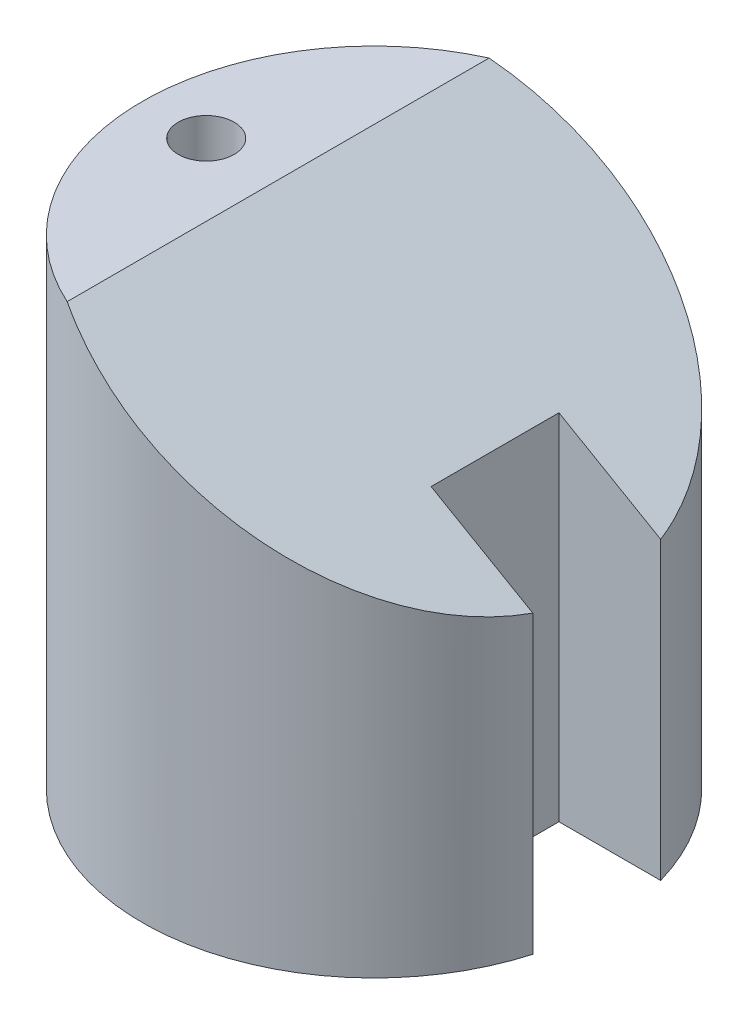
from build123d import *

# Parameters (mm, degrees)
SKETCH1_R               = 29
BOSS_EXTRUDE1_DEPTH     = 60
CUT_EXTRUDE1_DEPTH      = 73.677369242
CUT_EXTRUDE1_DEPTH_BACK = 73.677369242
CUT_EXTRUDE3_DEPTH      = 8
CUT_EXTRUDE3_DEPTH_BACK = 8
CUT_EXTRUDE4_REACH      = 74.677
SKETCH7_R               = 3.5


with BuildPart() as part:
    # Sketch1 → Boss-Extrude1 (new body)
    with BuildSketch(Plane(origin=(0, 0, 0), x_dir=(1, 0, 0), z_dir=(0, 1, 0))):
        Circle(SKETCH1_R)
    extrude(amount=BOSS_EXTRUDE1_DEPTH)

    # Sketch2 → Cut-Extrude1 (cut, two sides: drawn at the far end of the back side and taken through both)
    with BuildSketch(Plane.XY.offset(-CUT_EXTRUDE1_DEPTH_BACK)):
        Polygon((-12, 60), (29, 36.328638963), (29, 60), align=None)
    extrude(amount=CUT_EXTRUDE1_DEPTH + CUT_EXTRUDE1_DEPTH_BACK, mode=Mode.SUBTRACT)

    # Sketch6 → Cut-Extrude3 (cut, two sides: drawn at the far end of the back side and taken through both)
    with BuildSketch(Plane.XY.offset(-CUT_EXTRUDE3_DEPTH_BACK)):
        Polygon((15.143593539, 44.328638963), (29, 36.328638963), (29, 0), (15.143593539, 0), align=None)
    extrude(amount=CUT_EXTRUDE3_DEPTH + CUT_EXTRUDE3_DEPTH_BACK, mode=Mode.SUBTRACT)

    # Sketch7 → Cut-Extrude4 (cut, up to next)
    with BuildSketch(Plane(origin=(0, 60, 0), x_dir=(1, 0, 0), z_dir=(0, 1, 0)), mode=Mode.PRIVATE) as cut_extrude4_sk1:
        with Locations((-21, 0)):
            Circle(SKETCH7_R)
    cut_extrude4_tool1 = extrude(cut_extrude4_sk1.sketch, amount=-CUT_EXTRUDE4_REACH, mode=Mode.PRIVATE) & part.part
    add(cut_extrude4_tool1.solids().sort_by_distance((-21, 60, 0))[0], mode=Mode.SUBTRACT)


solid = part.part
